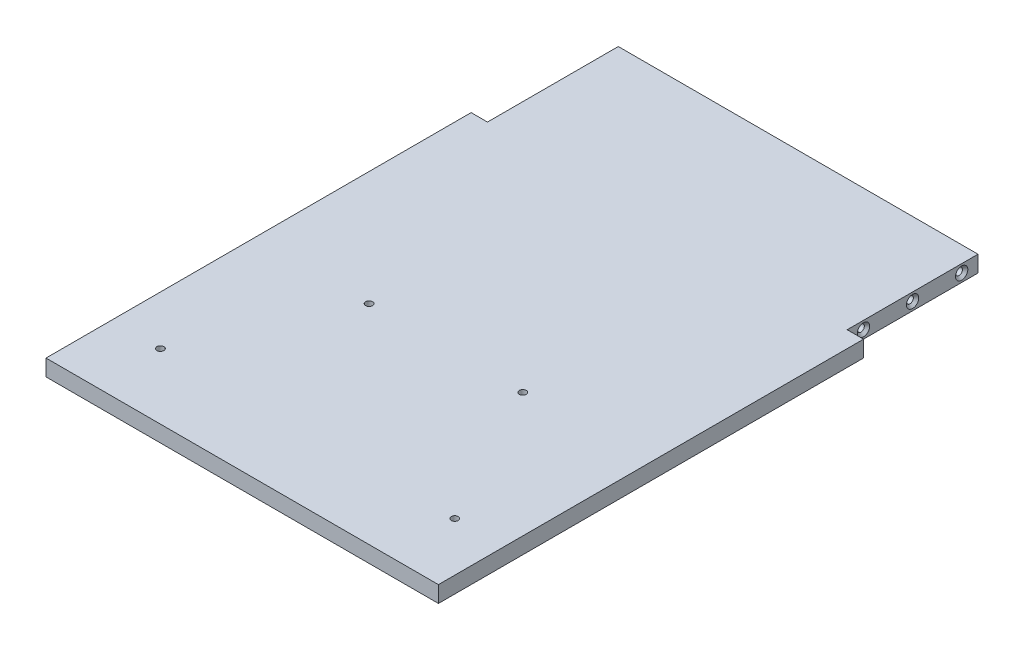
from build123d import *

# Parameters (mm, degrees)
BOSS_EXTRUDE1_DEPTH             = 6.35
F_6_32_TAPPED_HOLE1_D           = 2.7051
F_6_32_TAPPED_HOLE1_DEPTH       = 11.88730597
F_6_32_TAPPED_HOLE1_CSINK_D     = 4.7752
F_6_32_TAPPED_HOLE1_CSINK_ANGLE = 90
F_6_32_TAPPED_HOLE1_TIP         = 0.81269403
F_6_32_TAPPED_HOLE2_D           = 2.7051
F_6_32_TAPPED_HOLE2_DEPTH       = 11.88730597
F_6_32_TAPPED_HOLE2_CSINK_D     = 4.7752
F_6_32_TAPPED_HOLE2_CSINK_ANGLE = 90
F_6_32_TAPPED_HOLE2_TIP         = 0.81269403
F_6_32_TAPPED_HOLE3_D           = 2.7051
F_6_32_TAPPED_HOLE4_D           = 2.7051


with BuildPart() as part:
    # Sketch1 → Boss-Extrude1 (new body)
    with BuildSketch(Plane(origin=(0, 0, 0), x_dir=(1, 0, 0), z_dir=(0, 1, 0))):
        Polygon((-6.35, 0), (-6.35, -50.8), (0, -50.8), (0, -215.9), (-152.4, -215.9), (-152.4, -50.8), (-146.05, -50.8), (-146.05, 0), align=None)
    extrude(amount=BOSS_EXTRUDE1_DEPTH)

    # #6-32 Tapped Hole1
    with Locations(Plane(origin=(-6.35, 0, 0), x_dir=(0, 0, -1), z_dir=(1, 0, 0))):
        with Locations((-44.45, 3.175), (-25.4, 3.175), (-6.35, 3.175)):
            CounterSinkHole(F_6_32_TAPPED_HOLE1_D / 2, F_6_32_TAPPED_HOLE1_CSINK_D / 2, depth=F_6_32_TAPPED_HOLE1_DEPTH, counter_sink_angle=F_6_32_TAPPED_HOLE1_CSINK_ANGLE)
            with Locations((0, 0, -(F_6_32_TAPPED_HOLE1_DEPTH + F_6_32_TAPPED_HOLE1_TIP / 2))):  # 118° drill point
                Cone(0, F_6_32_TAPPED_HOLE1_D / 2, F_6_32_TAPPED_HOLE1_TIP, mode=Mode.SUBTRACT)

    # #6-32 Tapped Hole2
    with Locations(Plane.ZY.offset(146.05)):
        with Locations((6.35, 3.175), (25.4, 3.175), (44.45, 3.175)):
            CounterSinkHole(F_6_32_TAPPED_HOLE2_D / 2, F_6_32_TAPPED_HOLE2_CSINK_D / 2, depth=F_6_32_TAPPED_HOLE2_DEPTH, counter_sink_angle=F_6_32_TAPPED_HOLE2_CSINK_ANGLE)
            with Locations((0, 0, -(F_6_32_TAPPED_HOLE2_DEPTH + F_6_32_TAPPED_HOLE2_TIP / 2))):  # 118° drill point
                Cone(0, F_6_32_TAPPED_HOLE2_D / 2, F_6_32_TAPPED_HOLE2_TIP, mode=Mode.SUBTRACT)

    # #6-32 Tapped Hole3 (through all)
    with Locations(Plane(origin=(0, 6.35, 0), x_dir=(1, 0, 0), z_dir=(0, 1, 0))):
        with Locations((-133.35, -190.5), (-19.05, -190.5)):
            Hole(F_6_32_TAPPED_HOLE3_D / 2)

    # #6-32 Tapped Hole4 (through all)
    with Locations(Plane(origin=(0, 6.35, 0), x_dir=(1, 0, 0), z_dir=(0, 1, 0))):
        with Locations((-107.95, -134.874), (-48.26, -134.874)):
            Hole(F_6_32_TAPPED_HOLE4_D / 2)


solid = part.part
